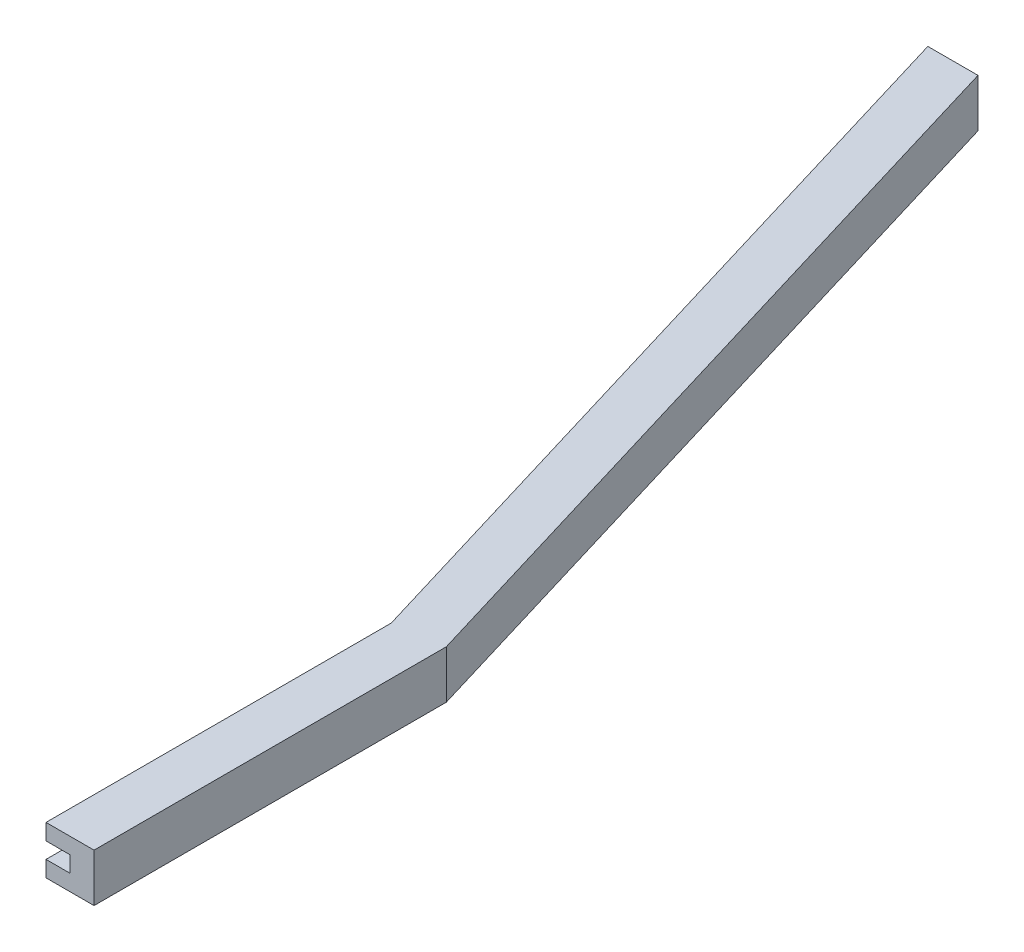
from build123d import *

# Parameters (mm, degrees)
EXTRUDE_1_DEPTH                   = 3
SKETCH_2_R                        = 1.5
SKETCH_2_R_2                      = 0.75
EXTRUDE_2_DEPTH                   = 73
SKETCH_3_W                        = 42
SKETCH_3_H                        = 3.5
SKETCH_3_W_2                      = 3.2
SKETCH_3_H_2                      = 20.2
CUT_EXTRUDE_1_DEPTH               = 83.725086884
CUT_EXTRUDE_2_REACH               = 84.028
CUT_EXTRUDE_2_OFFSET_FROM_SURFACE = 1.5
CUT_EXTRUDE_START                 = -1.5
SKETCH_4_W                        = 44.5
SKETCH_4_H                        = 1
SKETCH_4_3_W                      = 22
SKETCH_4_3_H                      = 1
CUT_EXTRUDE_3_DEPTH               = 37.5
SKETCH_5_W                        = 3
SKETCH_5_H                        = 1
EXTRUDE_3_DEPTH                   = 34.5
SKETCH_6_R                        = 0.35
CUT_EXTRUDE_4_DEPTH               = 80.653562381
SKETCH_7_W                        = 24.036657481
SKETCH_7_H                        = 1
CUT_EXTRUDE_5_DEPTH               = 1.5
SKETCH_8_OUTSIDE_W                = 60.252
SKETCH_8_OUTSIDE_H                = 87.752
CUT_EXTRUDE_6_DEPTH               = 80.653562381


with BuildPart() as part:
    # 草图1 → 凸台-拉伸1 (new body)
    with BuildSketch(Plane(origin=(0, 0, 0), x_dir=(1, 0, 0), z_dir=(0, 1, 0))):
        Polygon((0, 0), (0, -73), (38.8, -73), (38.8, -47.5), (24.5, 0), align=None)
    extrude(amount=EXTRUDE_1_DEPTH)

    # 草图2 → 凸台-拉伸2 (add)
    # profile 1 of 2: a face of its own
    with BuildSketch(Plane(origin=(0, 0, 0), x_dir=(-1, 0, 0), z_dir=(0, 0, -1))):
        with BuildLine():
            Line((0, 3), (0, 0))
            Line((0, 0), (1.7, 0))
            ThreePointArc((1.7, 0), (0.2, 1.5), (1.7, 3))
            Line((1.7, 3), (0, 3))
        make_face()
    # profile 2 of 2: a face of its own
    with BuildSketch(Plane(origin=(0, 0, 0), x_dir=(-1, 0, 0), z_dir=(0, 0, -1))):
        with Locations((1.7, 1.5)):
            Circle(SKETCH_2_R)
        with Locations((1.7, 1.5)):
            Circle(SKETCH_2_R_2, mode=Mode.SUBTRACT)
    extrude(amount=-EXTRUDE_2_DEPTH)

    # 草图3 → 切除-拉伸1 (cut, through all)
    with BuildSketch(Plane(origin=(0, 3, 0), x_dir=(1, 0, 0), z_dir=(0, 1, 0))):
        with Locations((17.8, -71.25)):
            Rectangle(SKETCH_3_W, SKETCH_3_H)
        with Locations((-1.6, -38.1)):
            Rectangle(SKETCH_3_W_2, SKETCH_3_H_2)
        Polygon((1.3, -3), (22.270157068, -3), (35.8, -47.941785964), (35.8, -69.5), (1.3, -69.5), align=None)
    extrude(amount=-CUT_EXTRUDE_1_DEPTH, mode=Mode.SUBTRACT)

    # 切除-拉伸2: up to this face of the body (flat: up to its plane, moved by the offset)
    cut_extrude_2_end = Plane(part.part.faces().sort_by_distance((29.035078534, 1.5, 25.470892982))[0]).offset(-CUT_EXTRUDE_2_OFFSET_FROM_SURFACE)
    # 草图4 → 切除-拉伸2 (cut, up to the picked face)
    with BuildSketch(Plane(origin=(1.3, 0, 0), x_dir=(0, 0, -1), z_dir=(1, 0, 0)).offset(CUT_EXTRUDE_START), mode=Mode.PRIVATE) as cut_extrude_2_sk1:
        with Locations((-25.25, 1.5)):
            Rectangle(SKETCH_4_W, SKETCH_4_H)
    cut_extrude_2_tool1 = split(extrude(cut_extrude_2_sk1.sketch, amount=CUT_EXTRUDE_2_REACH, mode=Mode.PRIVATE), bisect_by=cut_extrude_2_end, keep=Keep.BOTH, mode=Mode.PRIVATE)
    add(cut_extrude_2_tool1.solids().sort_by(Axis((-0.2, 1.5, 25.25), (1, 0, 0)))[0], mode=Mode.SUBTRACT)

    # 草图4<3> → 切除-拉伸3 (cut)
    with BuildSketch(Plane(origin=(1.3, 0, 0), x_dir=(0, 0, -1), z_dir=(1, 0, 0)).offset(CUT_EXTRUDE_START)):
        with Locations((-58.5, 1.5)):
            Rectangle(SKETCH_4_3_W, SKETCH_4_3_H)
    extrude(amount=CUT_EXTRUDE_3_DEPTH, mode=Mode.SUBTRACT)

    # 草图5 → 凸台-拉伸3 (add)
    with BuildSketch(Plane.ZY.offset(-35.8)):
        with Locations((49.441785964, 2.5)):
            Rectangle(SKETCH_5_W, SKETCH_5_H)
    extrude(amount=EXTRUDE_3_DEPTH)

    # 草图6 → 切除-拉伸4 (cut, through all)
    with BuildSketch(Plane(origin=(0, 3, 0), x_dir=(1, 0, 0), z_dir=(0, 1, 0))):
        with Locations(Location((32.8, -49.441785964, 0), (0, 0, 270))):
            Circle(SKETCH_6_R)
        with Locations(Location((24.9, -49.441785964, 0), (0, 0, 270))):
            Circle(SKETCH_6_R)
    extrude(amount=-CUT_EXTRUDE_4_DEPTH, mode=Mode.SUBTRACT)

    # 草图7 → 切除-拉伸5 (cut)
    with BuildSketch(Plane.XY.offset(3)):
        with Locations((11.818328741, 1.5)):
            Rectangle(SKETCH_7_W, SKETCH_7_H)
    extrude(amount=-CUT_EXTRUDE_5_DEPTH, mode=Mode.SUBTRACT)

    # 草图8 outside → 切除-拉伸6 (cut, through all)
    with BuildSketch(Plane(origin=(0, 3, 0), x_dir=(1, 0, 0), z_dir=(0, 1, 0))):
        with Locations((17.8, -34.75)):
            Rectangle(SKETCH_8_OUTSIDE_W, SKETCH_8_OUTSIDE_H)
        Polygon((20.332372981, 3.436695391), (35.8, -47.941785964), (35.8, -72.849501568), (56.307983414, -72.849501568), (56.307983414, 3.436695391), align=None, mode=Mode.SUBTRACT)
    extrude(amount=-CUT_EXTRUDE_6_DEPTH, mode=Mode.SUBTRACT)


solid = part.part
